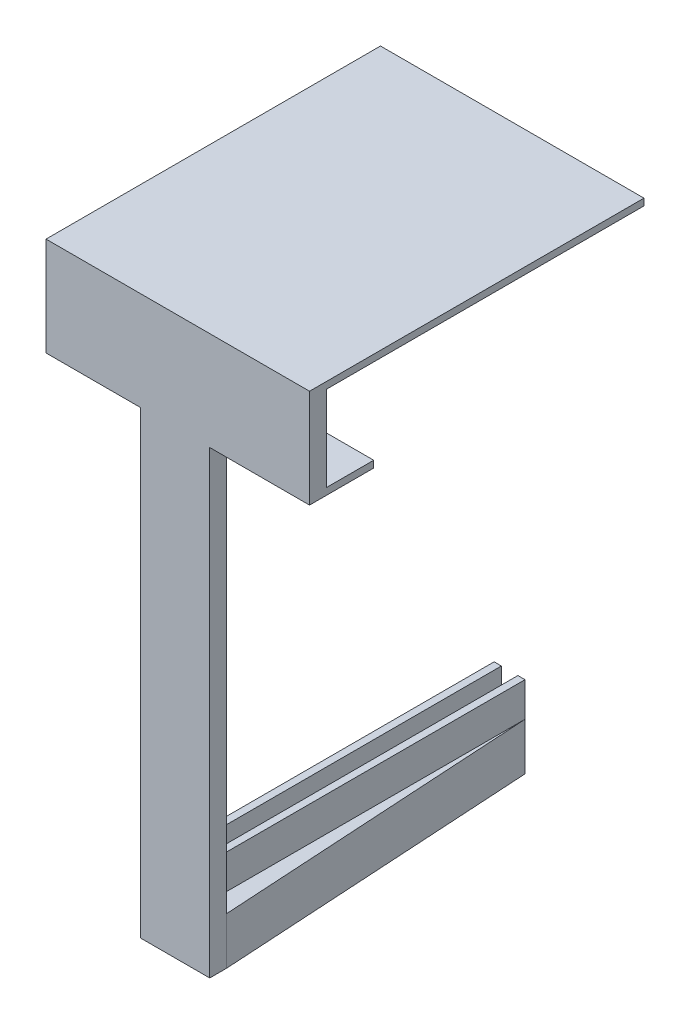
from build123d import *

# Parameters (mm, degrees)
EXTRUDE_1_DEPTH      = 1
EXTRUDE_2_DEPTH      = 2.5
EXTRUDE_2_DEPTH_BACK = 47
SKETCH_2_W           = 39
SKETCH_2_H           = 1
SKETCH_3_W           = 39
SKETCH_3_H           = 2.5
EXTRUDE_3_DEPTH      = 12.6
SKETCH_5_W           = 39
SKETCH_5_H           = 2.5
EXTRUDE_4_DEPTH      = 1
SKETCH_6_W           = 39
SKETCH_6_H           = 1.003738559
EXTRUDE_5_DEPTH      = 7
SKETCH_7_W           = 10.218852435
SKETCH_7_H           = 2.5
EXTRUDE_6_DEPTH      = 60
SKETCH_8_W           = 10.218852435
SKETCH_8_H           = 2.5
EXTRUDE_7_DEPTH      = 8
SKETCH_9_W           = 1.056054664
SKETCH_9_H           = 12.077363823
SKETCH_9_W_2         = 1.071222475
EXTRUDE_8_DEPTH      = 47
EXTRUDE_9_DEPTH      = 7


with BuildPart() as part:
    # 草圖1 → 填料-伸長1 (new body)
    with BuildSketch(Plane(origin=(0, 0, 0), x_dir=(1, 0, 0), z_dir=(0, 1, 0))):
        Polygon((-19.5, 0), (19.5, 0), (19.5, 7.09904377), (-12.701429462, 7.09904377), (-19.5, 10.228453209), align=None)
    extrude(amount=-EXTRUDE_1_DEPTH)

    # 草圖2 → 填料-伸長2 (add, two sides: drawn at the far end of the back side and taken through both)
    with BuildSketch(Plane.XY.offset(-EXTRUDE_2_DEPTH_BACK)):
        with Locations((0, -0.5)):
            Rectangle(SKETCH_2_W, SKETCH_2_H)
    extrude(amount=EXTRUDE_2_DEPTH + EXTRUDE_2_DEPTH_BACK)

    # 草圖3 → 填料-伸長3 (add)
    with BuildSketch(Plane.XZ.offset(1)):
        with Locations((0, 1.25)):
            Rectangle(SKETCH_3_W, SKETCH_3_H)
    extrude(amount=EXTRUDE_3_DEPTH)

    # 草圖5 → 填料-伸長4 (add)
    with BuildSketch(Plane.XZ.offset(13.6)):
        with Locations((0, 1.25)):
            Rectangle(SKETCH_5_W, SKETCH_5_H)
    extrude(amount=EXTRUDE_4_DEPTH)

    # 草圖6 → 填料-伸長5 (add)
    with BuildSketch(Plane(origin=(0, 0, 0), x_dir=(-1, 0, 0), z_dir=(0, 0, -1))):
        with Locations((0, -14.098130721)):
            Rectangle(SKETCH_6_W, SKETCH_6_H)
    extrude(amount=EXTRUDE_5_DEPTH)

    # 草圖7 → 填料-伸長6 (add)
    with BuildSketch(Plane.XZ.offset(14.6)):
        with Locations((-0.382201174, 1.25)):
            Rectangle(SKETCH_7_W, SKETCH_7_H)
    extrude(amount=EXTRUDE_6_DEPTH)

    # 草圖8 → 填料-伸長7 (add)
    with BuildSketch(Plane.XZ.offset(74.6)):
        with Locations((-0.382201174, 1.25)):
            Rectangle(SKETCH_8_W, SKETCH_8_H)
    extrude(amount=EXTRUDE_7_DEPTH)

    # 草圖9 → 填料-伸長8 (add)
    with BuildSketch(Plane(origin=(0, 0, 0), x_dir=(-1, 0, 0), z_dir=(0, 0, -1))):
        with Locations((-1.369349297, -76.561318089)):
            Rectangle(SKETCH_9_W, SKETCH_9_H)
        with Locations((2.14133555, -76.561318089)):
            Rectangle(SKETCH_9_W_2, SKETCH_9_H)
    extrude(amount=EXTRUDE_8_DEPTH)

    # 草圖10 → 填料-伸長9 (add)
    with BuildSketch(Plane.XZ.offset(82.6)):
        Polygon((-5.491627391, 0), (-2.676946787, -47), (-2.676946787, 0), align=None)
        Polygon((1.897376629, 0), (4.727225044, 0), (1.897376629, -47), align=None)
    extrude(amount=-EXTRUDE_9_DEPTH)


solid = part.part
